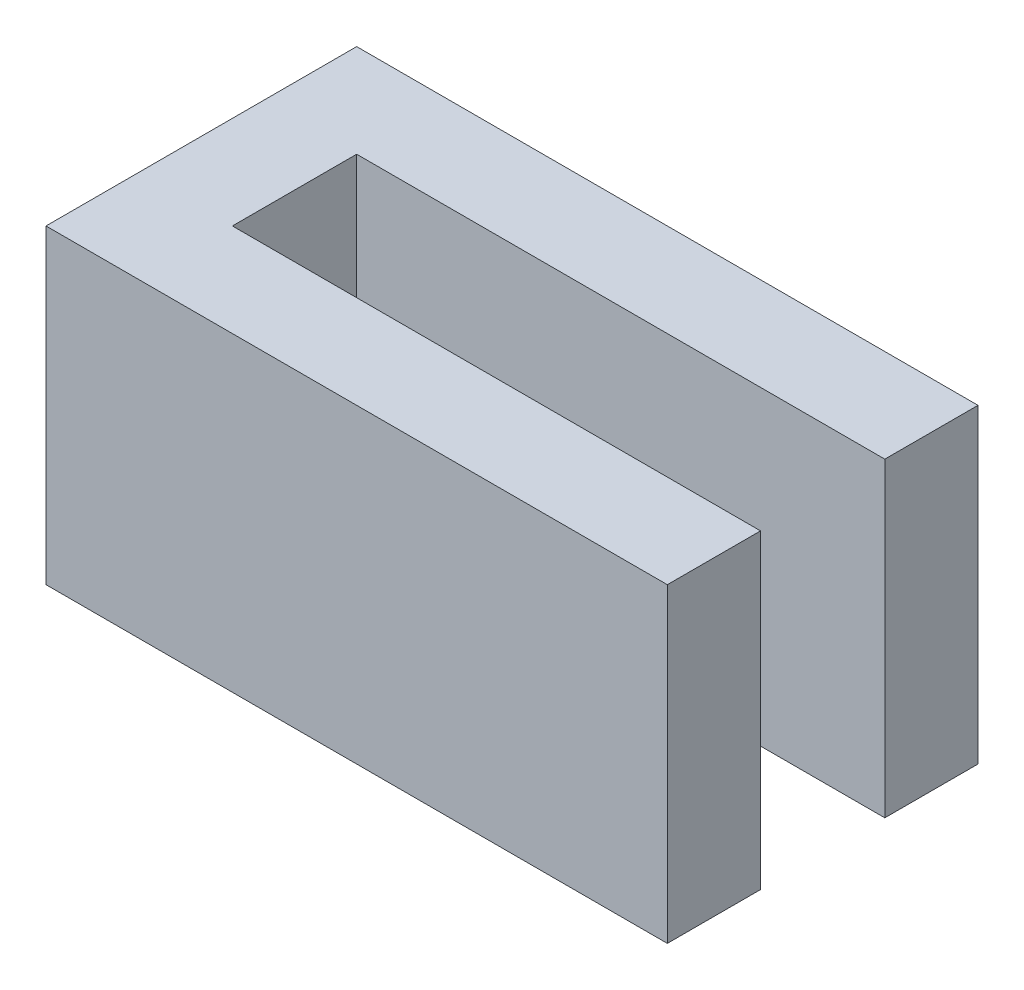
from build123d import *

# Parameters (mm, degrees)
BOSS_EXTRUDE1_DEPTH = 50


with BuildPart() as part:
    # Sketch1 → Boss-Extrude1 (new body)
    with BuildSketch(Plane(origin=(0, 0, 0), x_dir=(1, 0, 0), z_dir=(0, 1, 0))):
        Polygon((0, 0), (100, 0), (100, 15), (15, 15), (15, 35), (100, 35), (100, 50), (0, 50), align=None)
    extrude(amount=BOSS_EXTRUDE1_DEPTH)


solid = part.part
